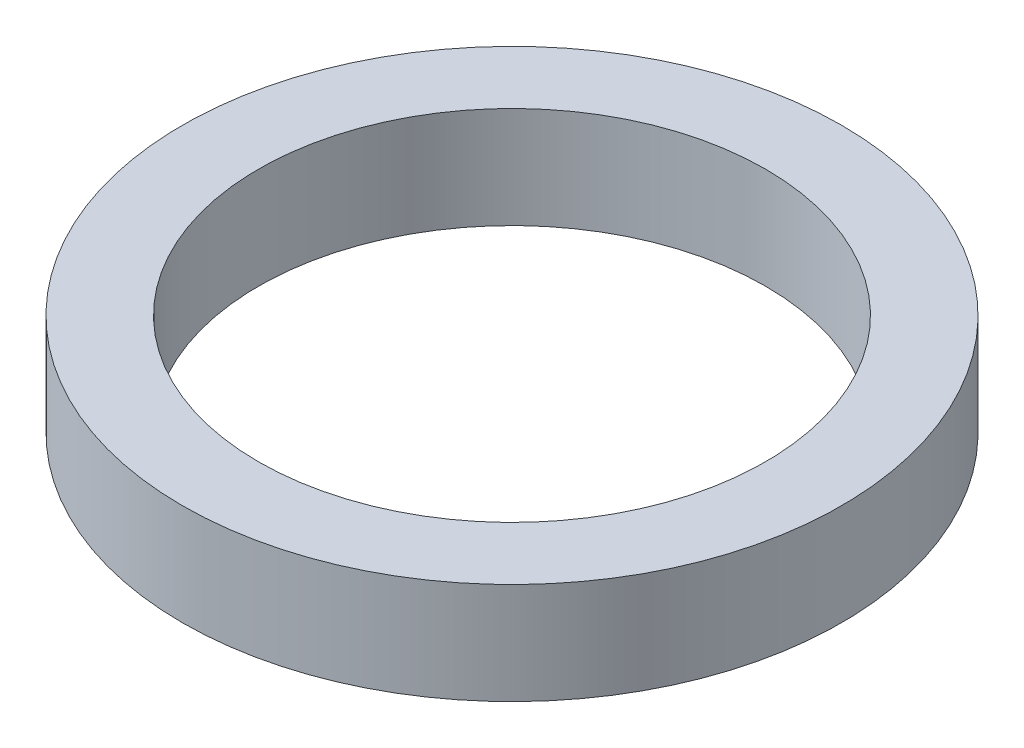
from build123d import *

# Parameters (mm, degrees)
SKETCH3_R           = 6.5
SKETCH3_R_2         = 5
BOSS_EXTRUDE3_DEPTH = 2


with BuildPart() as part:
    # Sketch3 → Boss-Extrude3 (new body)
    with BuildSketch(Plane(origin=(0, 0, 0), x_dir=(1, 0, 0), z_dir=(0, 1, 0))):
        with Locations(Location((0, 0, 0), (0, 0, 270))):
            Circle(SKETCH3_R)
        with Locations(Location((0, 0, 0), (0, 0, 270))):
            Circle(SKETCH3_R_2, mode=Mode.SUBTRACT)
    extrude(amount=BOSS_EXTRUDE3_DEPTH)


solid = part.part
